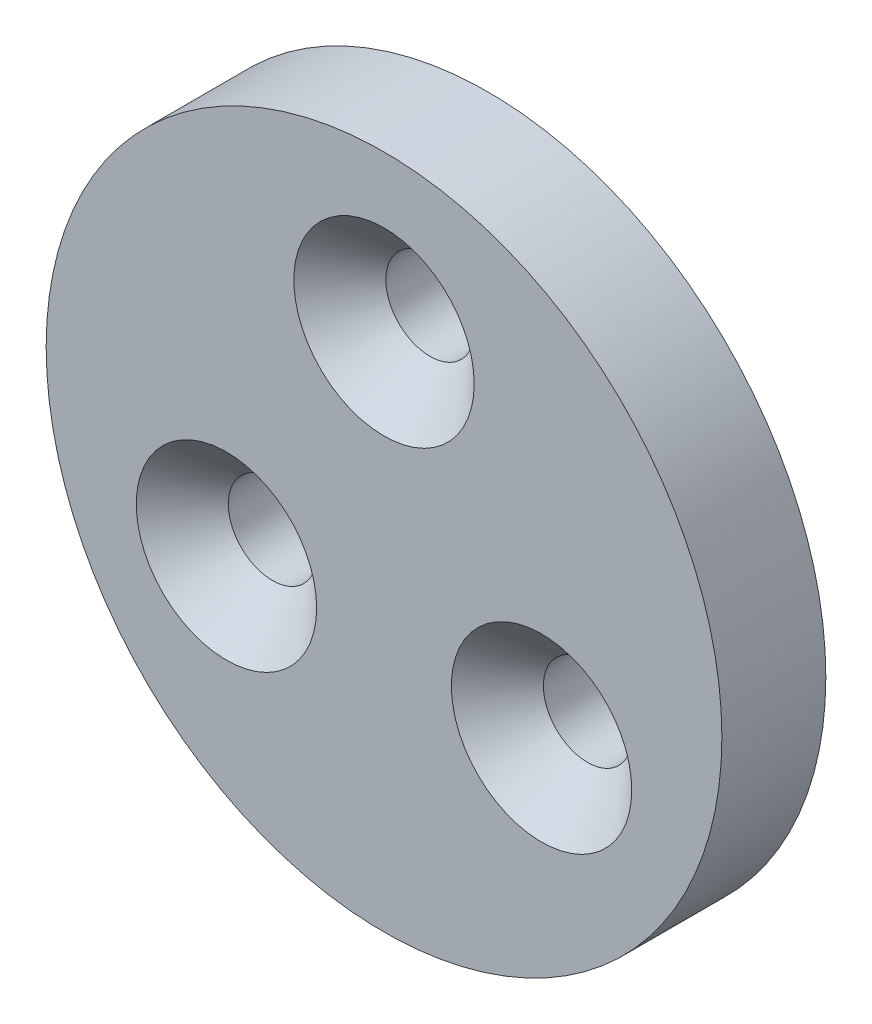
from build123d import *

# Parameters (mm, degrees)
SKETCH1_R                                            = 13
BOSS_EXTRUDE1_DEPTH                                  = 4
CSK_FOR_M3_HEX_SOCKET_COUNTERSUNK_HEAD_S_D           = 3.4
CSK_FOR_M3_HEX_SOCKET_COUNTERSUNK_HEAD_S_DEPTH       = 12
CSK_FOR_M3_HEX_SOCKET_COUNTERSUNK_HEAD_S_CSINK_D     = 6.94
CSK_FOR_M3_HEX_SOCKET_COUNTERSUNK_HEAD_S_CSINK_ANGLE = 90
CSK_FOR_M3_HEX_SOCKET_COUNTERSUNK_HEAD_S_TIP         = 1.021463052


with BuildPart() as part:
    # Sketch1 → Boss-Extrude1 (new body)
    with BuildSketch(Plane.XY):
        Circle(SKETCH1_R)
    extrude(amount=BOSS_EXTRUDE1_DEPTH)

    # CSK for M3 Hex Socket Countersunk Head Screw1
    with Locations(Plane.XY.offset(4)):
        with Locations((0, 7), (6.062177826, -3.5), (-6.062177826, -3.5)):
            CounterSinkHole(CSK_FOR_M3_HEX_SOCKET_COUNTERSUNK_HEAD_S_D / 2, CSK_FOR_M3_HEX_SOCKET_COUNTERSUNK_HEAD_S_CSINK_D / 2, depth=CSK_FOR_M3_HEX_SOCKET_COUNTERSUNK_HEAD_S_DEPTH, counter_sink_angle=CSK_FOR_M3_HEX_SOCKET_COUNTERSUNK_HEAD_S_CSINK_ANGLE)
            with Locations((0, 0, -(CSK_FOR_M3_HEX_SOCKET_COUNTERSUNK_HEAD_S_DEPTH + CSK_FOR_M3_HEX_SOCKET_COUNTERSUNK_HEAD_S_TIP / 2))):  # 118° drill point
                Cone(0, CSK_FOR_M3_HEX_SOCKET_COUNTERSUNK_HEAD_S_D / 2, CSK_FOR_M3_HEX_SOCKET_COUNTERSUNK_HEAD_S_TIP, mode=Mode.SUBTRACT)


solid = part.part
